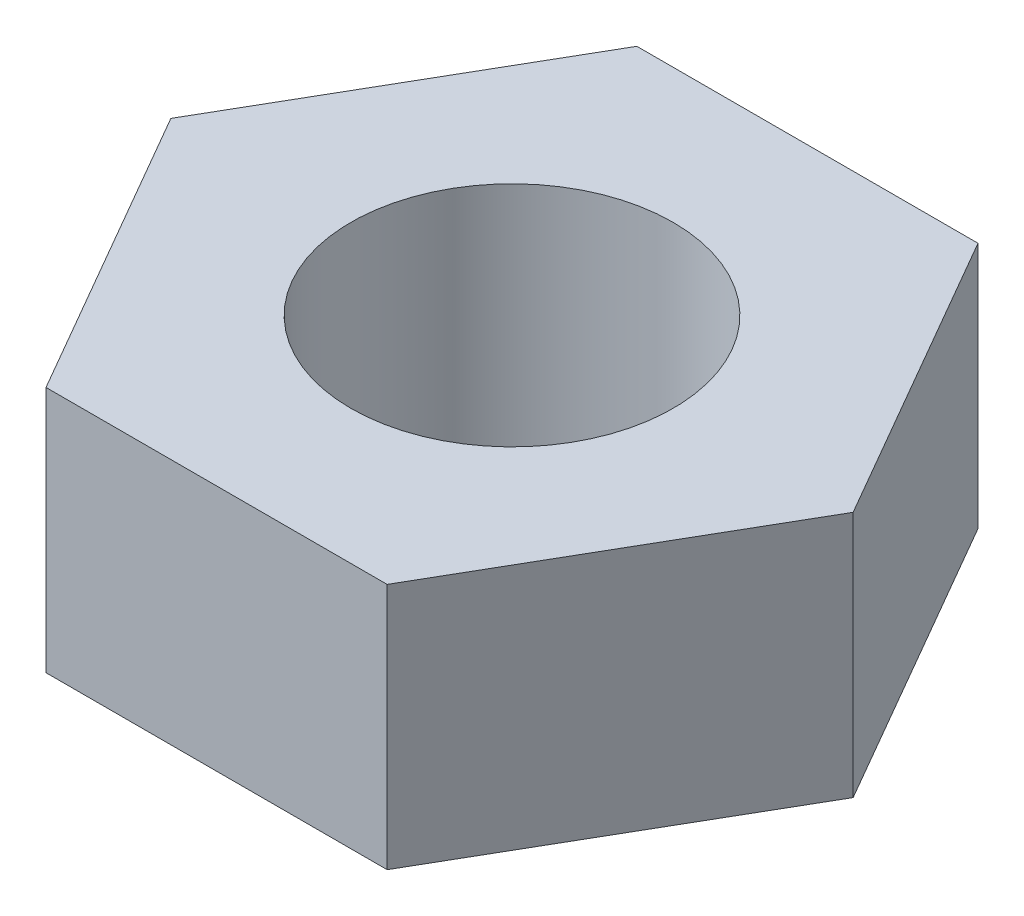
from build123d import *

# Parameters (mm, degrees)
SKETCH1_R           = 1.5
BOSS_EXTRUDE1_DEPTH = 2.3


with BuildPart() as part:
    # Sketch1 → Boss-Extrude1 (new body)
    with BuildSketch(Plane(origin=(0, 0, 0), x_dir=(1, 0, 0), z_dir=(0, 1, 0))):
        Polygon((3.175426481, 0), (1.58771324, 2.75), (-1.58771324, 2.75), (-3.175426481, 0), (-1.58771324, -2.75), (1.58771324, -2.75), align=None)
        with Locations(Location((0, 0, 0), (0, 0, 270))):
            Circle(SKETCH1_R, mode=Mode.SUBTRACT)
    extrude(amount=BOSS_EXTRUDE1_DEPTH)


solid = part.part
